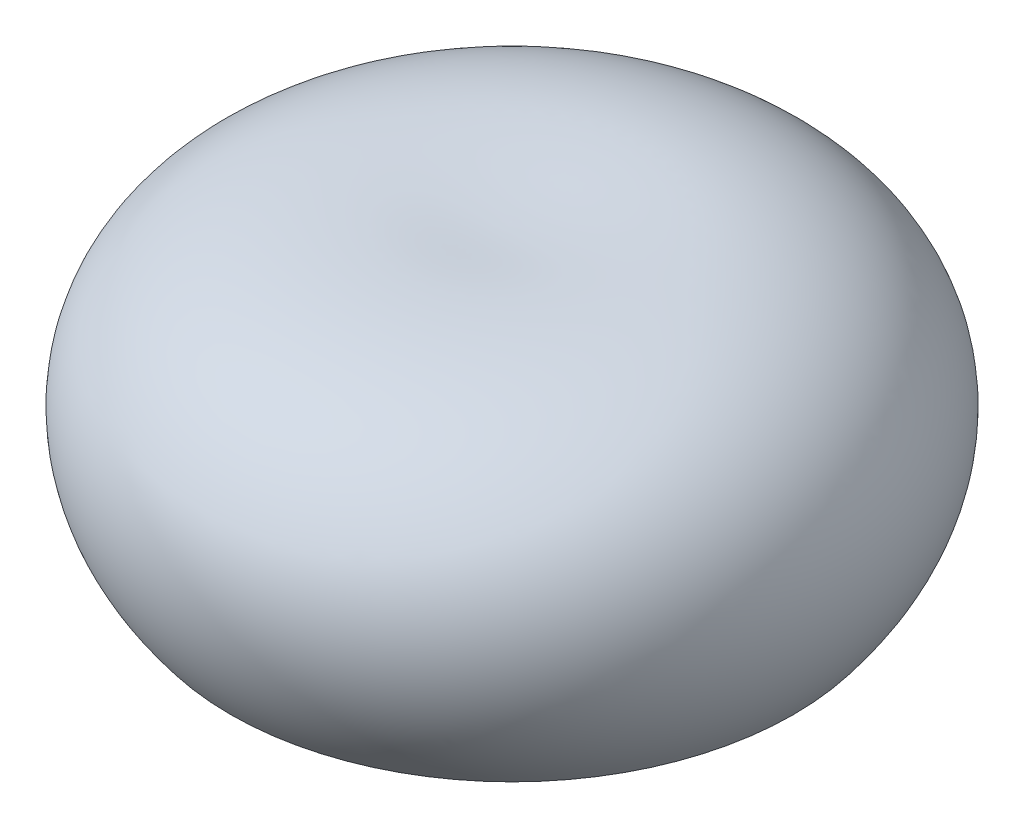
from build123d import *


with BuildPart() as part:
    # 草图3 → 旋转1 (revolve)
    with BuildSketch(Plane.XY):
        with BuildLine():
            Line((0, 7), (0, 0))
            Line((0, 0), (6.871524, 0))
            add(Edge.make_bspline(
                [(0, 7), (0.073827133, 6.999533892), (0.178318357, 6.998874186), (0.306371082, 7.001499066), (0.380532001, 7.003447371), (0.44163275, 7.005414874), (0.495099375, 7.007375358), (0.543337939, 7.009328467), (0.587692174, 7.011274662), (0.62900892, 7.013208302), (0.667864574, 7.01513245), (0.704674056, 7.01704083), (0.739746516, 7.018935719), (0.773321365, 7.020815477), (0.805587195, 7.022680946), (0.836696698, 7.024531001), (0.866775289, 7.026364097), (0.895926819, 7.028182386), (0.92424, 7.029984755), (0.951789678, 7.031768518), (0.978640164, 7.033538818), (1.004847801, 7.035290763), (1.030461401, 7.037026909), (1.055524621, 7.038747334), (1.080075561, 7.040450285), (1.104148873, 7.042135989), (1.127774491, 7.043805743), (1.150980061, 7.045459817), (1.173790345, 7.047096538), (1.196228349, 7.048715852), (1.21831425, 7.050319891), (1.240066936, 7.05190598), (1.261503173, 7.053476977), (1.282639187, 7.055030127), (1.303489485, 7.056567608), (1.324067415, 7.058089226), (1.344385372, 7.05959381), (1.364454785, 7.06108041), (1.38428631, 7.062553647), (1.403890354, 7.064008392), (1.423276267, 7.065448232), (1.442452636, 7.066870081), (1.461427601, 7.068276548), (1.480208588, 7.069666736), (1.498802901, 7.071041002), (1.517217542, 7.072399364), (1.535458874, 7.073741376), (1.553532799, 7.075068082), (1.571445213, 7.076376654), (1.589201149, 7.077671204), (1.606806139, 7.078949351), (1.624264792, 7.080211552), (1.641582107, 7.081457816), (1.65876215, 7.082687569), (1.675808752, 7.08390315), (1.692726084, 7.085102192), (1.709518068, 7.086285448), (1.726188441, 7.087452225), (1.742740379, 7.088604811), (1.759177426, 7.089740488), (1.775502371, 7.090861982), (1.791718366, 7.091967091), (1.807828401, 7.09305595), (1.823835055, 7.094130165), (1.839741065, 7.095189049), (1.85554896, 7.096234019), (1.871261098, 7.097259952), (1.886879701, 7.098273623), (1.902406998, 7.099271914), (1.917845712, 7.100253549), (1.933197649, 7.101221273), (1.948464748, 7.102171391), (1.963648643, 7.103109491), (1.978751408, 7.104029595), (1.993774643, 7.104937619), (2.008720735, 7.105827809), (2.02359065, 7.106705638), (2.038386356, 7.107566375), (2.053109061, 7.108412093), (2.067760644, 7.109244979), (2.082342731, 7.110060174), (2.096856351, 7.110862757), (2.111302695, 7.111649647), (2.125683354, 7.112421865), (2.139999726, 7.113178548), (2.154253027, 7.113921927), (2.16844436, 7.114650026), (2.182574738, 7.115362568), (2.196645325, 7.116062617), (2.210657444, 7.116744277), (2.224611994, 7.11741581), (2.238510113, 7.11806838), (2.252352674, 7.118710787), (2.266140749, 7.119334935), (2.27987541, 7.11994616), (2.293557055, 7.120543437), (2.307187085, 7.121125216), (2.320766088, 7.121693253), (2.334295403, 7.122247514), (2.347775404, 7.122786663), (2.361207128, 7.123309997), (2.374590743, 7.123821817), (2.387927781, 7.124317303), (2.40121842, 7.124799912), (2.414463811, 7.125266091), (2.42766443, 7.125720992), (2.440821131, 7.126159489), (2.453934464, 7.126584694), (2.46700514, 7.126995587), (2.480033455, 7.127393071), (2.493020504, 7.127774283), (2.505966464, 7.128144259), (2.518872515, 7.128497291), (2.53173881, 7.128839321), (2.544566191, 7.12916436), (2.557354824, 7.129478356), (2.570105535, 7.129775418), (2.582818505, 7.130061396), (2.595494544, 7.13033055), (2.608134199, 7.130588093), (2.620737876, 7.130830963), (2.633305882, 7.131060023), (2.645838889, 7.131275039), (2.658337228, 7.131476135), (2.670801578, 7.131662797), (2.683232241, 7.131837195), (2.695629583, 7.131997104), (2.707994257, 7.132143137), (2.720326263, 7.132275252), (2.732626277, 7.132392878), (2.74489461, 7.132498364), (2.757131624, 7.132588915), (2.769337959, 7.132667332), (2.781513968, 7.132731228), (2.793659642, 7.132781331), (2.805775651, 7.132817122), (2.817861991, 7.132839974), (2.829919332, 7.132850856), (2.841948005, 7.132844583), (2.853948349, 7.132828886), (2.865920688, 7.132796049), (2.877865028, 7.132751192), (2.889781706, 7.132693532), (2.901671376, 7.13262113), (2.913534055, 7.132536469), (2.925370399, 7.132437615), (2.937180391, 7.132323773), (2.948964424, 7.132200075), (2.960722739, 7.132058795), (2.972455433, 7.13190768), (2.984163107, 7.131741519), (2.995845773, 7.131561314), (3.007504115, 7.131368402), (3.019137788, 7.131162311), (3.030747477, 7.130943692), (3.042332803, 7.130710275), (3.053894828, 7.130464707), (3.065433155, 7.130204358), (3.076948499, 7.129931482), (3.088440504, 7.129645373), (3.099909865, 7.129346746), (3.111356854, 7.129033383), (3.122781534, 7.128707543), (3.134184204, 7.128368389), (3.145564902, 7.128016801), (3.156923889, 7.127650437), (3.168261235, 7.127271563), (3.179577238, 7.126879419), (3.190872277, 7.126474928), (3.202146231, 7.126055113), (3.213399629, 7.125624928), (3.224632274, 7.125179472), (3.235844622, 7.124721627), (3.247036956, 7.124250438), (3.258209338, 7.123767022), (3.269361943, 7.123268103), (3.280494695, 7.122759108), (3.291607959, 7.122234128), (3.302701711, 7.121699042), (3.313776343, 7.121148487), (3.324832028, 7.12058567), (3.335869035, 7.120009645), (3.346887376, 7.119420627), (3.357887055, 7.11881868), (3.368868395, 7.118203643), (3.379831407, 7.117575692), (3.390776409, 7.116934577), (3.401703467, 7.116281047), (3.412612724, 7.115612321), (3.423504444, 7.11493271), (3.434378498, 7.114240055), (3.44523475, 7.113532344), (3.456074141, 7.112813747), (3.466896485, 7.112081762), (3.477701817, 7.111336625), (3.488489885, 7.110579101), (3.499261125, 7.109806343), (3.510016192, 7.109022811), (3.520754863, 7.108225739), (3.531476876, 7.107415787), (3.542182545, 7.106592699), (3.552872223, 7.105756727), (3.563545915, 7.104907913), (3.574203518, 7.104045357), (3.584845313, 7.103172137), (3.595471594, 7.102283709), (3.606082229, 7.101382573), (3.616677284, 7.100469781), (3.627256687, 7.099544119), (3.637820904, 7.098603366), (3.648370328, 7.097651946), (3.658904656, 7.096686772), (3.669423667, 7.095708786), (3.67992769, 7.094717923), (3.690416948, 7.093713383), (3.700891776, 7.092698276), (3.71135197, 7.091667419), (3.721797724, 7.090625877), (3.732229124, 7.089571093), (3.742645685, 7.088501635), (3.753048344, 7.087420478), (3.763436836, 7.086328227), (3.773811426, 7.085220735), (3.784171725, 7.084100672), (3.794518457, 7.082968843), (3.804851134, 7.081823846), (3.815170148, 7.080665884), (3.825475479, 7.079494772), (3.835767183, 7.078311001), (3.84604542, 7.077113435), (3.856310283, 7.075905342), (3.866561442, 7.074681465), (3.876799547, 7.073446927), (3.887024559, 7.07219893), (3.897236473, 7.070937498), (3.907435665, 7.069665283), (3.917621172, 7.0683776), (3.927794251, 7.067078815), (3.937954277, 7.065766934), (3.948101629, 7.064441996), (3.958235857, 7.063103463), (3.968358062, 7.06175425), (3.978467235, 7.06038965), (3.988564318, 7.059013852), (3.998648667, 7.057624891), (4.008720701, 7.056223059), (4.018780237, 7.054807393), (4.028827819, 7.053381402), (4.038862939, 7.051939503), (4.048886063, 7.050486965), (4.058897075, 7.049020967), (4.068895971, 7.047541534), (4.0788832, 7.04605133), (4.088857991, 7.044545536), (4.098821127, 7.043029031), (4.108772433, 7.041498786), (4.118711818, 7.039956047), (4.128639788, 7.038399785), (4.138555747, 7.036830796), (4.148460496, 7.035249914), (4.158353495, 7.033655841), (4.168235195, 7.032048984), (4.178105515, 7.030428832), (4.18796423, 7.02879606), (4.197811442, 7.027149606), (4.207647567, 7.025491953), (4.217472252, 7.023820992), (4.227285893, 7.022136783), (4.237088274, 7.020439997), (4.246879619, 7.018729994), (4.256659491, 7.017006548), (4.266428764, 7.015272353), (4.276186825, 7.013522435), (4.285934358, 7.011762152), (4.295670652, 7.009987873), (4.305396008, 7.008200935), (4.315110558, 7.006400587), (4.324814837, 7.004589353), (4.334507582, 7.002762599), (4.344190052, 7.000924937), (4.35386173, 6.999073937), (4.36352275, 6.99720998), (4.373173066, 6.995332832), (4.382813104, 6.993442966), (4.392442644, 6.991539612), (4.40206195, 6.989625421), (4.411669961, 6.987695421), (4.421268286, 6.98575531), (4.430855693, 6.983799644), (4.440433174, 6.981832979), (4.450000162, 6.979852863), (4.459556867, 6.977859996), (4.469103214, 6.975854), (4.478639363, 6.973834416), (4.488165747, 6.971804498), (4.49768153, 6.969758755), (4.507187098, 6.967700589), (4.516683109, 6.965631446), (4.526168423, 6.963546451), (4.535644276, 6.961450921), (4.545110133, 6.95934238), (4.554565447, 6.957218423), (4.564011046, 6.955084215), (4.573446596, 6.952935655), (4.582872499, 6.950775294), (4.592288195, 6.948599592), (4.601694389, 6.94641305), (4.61109067, 6.944212776), (4.620477393, 6.941999965), (4.6298544, 6.939773941), (4.63922141, 6.937534937), (4.648578436, 6.935282993), (4.657925713, 6.933017712), (4.667263621, 6.930740315), (4.676591598, 6.928447484), (4.6859105, 6.926144058), (4.695219492, 6.923826975), (4.704518775, 6.921496728), (4.713808688, 6.919154318), (4.723088659, 6.916796511), (4.732359547, 6.914428003), (4.741621012, 6.912046127), (4.750872387, 6.909649623), (4.760115045, 6.907242158), (4.769347568, 6.904819891), (4.778570929, 6.90238495), (4.787784742, 6.899936539), (4.796989787, 6.89747724), (4.806185087, 6.895003064), (4.815370786, 6.892514574), (4.824547673, 6.890015011), (4.833715144, 6.887502128), (4.842872512, 6.88497467), (4.852021466, 6.882435993), (4.861160709, 6.879882955), (4.870291028, 6.87731686), (4.879411734, 6.874737958), (4.888523519, 6.872145992), (4.897625582, 6.869539672), (4.906719263, 6.866922171), (4.915803066, 6.864289775), (4.924877807, 6.861644991), (4.933943581, 6.858986975), (4.94299965, 6.856314704), (4.952047615, 6.853631002), (4.961085825, 6.850932877), (4.970115368, 6.848222194), (4.979134964, 6.845496485), (4.988146403, 6.84276022), (4.997148149, 6.84000868), (5.006141431, 6.83724522), (5.015125011, 6.834466485), (5.02410015, 6.831677299), (5.033065706, 6.828872897), (5.042022067, 6.826054552), (5.050970484, 6.823225166), (5.059908979, 6.820380913), (5.068838767, 6.817523916), (5.077759314, 6.814652837), (5.086671321, 6.811768821), (5.095574521, 6.808872058), (5.104468083, 6.805961029), (5.113352619, 6.803036595), (5.1222286, 6.800100168), (5.131095614, 6.797148503), (5.139954357, 6.794185351), (5.148803358, 6.791206655), (5.157643688, 6.788216255), (5.16647445, 6.785210206), (5.175297627, 6.782194633), (5.18411069, 6.779161498), (5.192915495, 6.776116863), (5.201711701, 6.773059081), (5.210498474, 6.769986725), (5.21927674, 6.766902107), (5.228045508, 6.763802744), (5.236806024, 6.760690887), (5.245557278, 6.757564957), (5.254300049, 6.754425875), (5.26303357, 6.751272767), (5.271758788, 6.748106997), (5.280474823, 6.744927049), (5.289181844, 6.741732494), (5.29788063, 6.73852635), (5.306569858, 6.735304461), (5.315250922, 6.732071155), (5.323922602, 6.728822598), (5.332586169, 6.725562394), (5.341239407, 6.722285342), (5.349885207, 6.718998409), (5.358520913, 6.715694395), (5.367149003, 6.712379128), (5.375767722, 6.709048695), (5.384377988, 6.705706009), (5.392978965, 6.702348911), (5.401571278, 6.698977818), (5.410154755, 6.695592637), (5.418730316, 6.692195344), (5.427295533, 6.688781343), (5.435853353, 6.685357356), (5.444400779, 6.681916555), (5.452940589, 6.67846403), (5.4614706, 6.674995864), (5.469992406, 6.671514836), (5.478504862, 6.668019623), (5.487009418, 6.664512264), (5.495504116, 6.660988362), (5.503990977, 6.657453258), (5.512468388, 6.65390261), (5.520937205, 6.650338931), (5.529397195, 6.64676087), (5.537848221, 6.643168893), (5.546290215, 6.639562842), (5.5547233, 6.635943001), (5.563147213, 6.632308328), (5.571563357, 6.628662494), (5.579969204, 6.624999241), (5.588367621, 6.621325253), (5.596756017, 6.61763451), (5.605136592, 6.61393211), (5.613507338, 6.610213829), (5.621869127, 6.606481658), (5.630222843, 6.60273681), (5.638567155, 6.598977057), (5.646902606, 6.595202545), (5.655229219, 6.591415123), (5.663546642, 6.587612553), (5.671855457, 6.583796843), (5.680155206, 6.579966985), (5.688445961, 6.576122804), (5.696727209, 6.572263539), (5.705000773, 6.568392043), (5.713264489, 6.564504733), (5.721519508, 6.560603741), (5.729765803, 6.55668899), (5.738002068, 6.55275878), (5.746230019, 6.548815672), (5.754448851, 6.544857976), (5.762658307, 6.540884486), (5.770859898, 6.536899), (5.779051608, 6.532897702), (5.787234608, 6.528882671), (5.795408715, 6.524854192), (5.803572831, 6.520809379), (5.811728496, 6.516752012), (5.819875135, 6.512679588), (5.828012468, 6.508592886), (5.836140991, 6.50449189), (5.844259923, 6.500375398), (5.852370543, 6.496245929), (5.860471776, 6.492102014), (5.868563261, 6.487942623), (5.87664547, 6.483768374), (5.884720161, 6.479582312), (5.892783757, 6.475378525), (5.900838844, 6.47116166), (5.908885114, 6.466930805), (5.916921597, 6.462684756), (5.924949633, 6.458424748), (5.932967338, 6.454148537), (5.940977502, 6.449860053), (5.948976347, 6.445554492), (5.956967513, 6.441236998), (5.964947875, 6.436902452), (5.972920211, 6.432554705), (5.980883037, 6.428191956), (5.988835952, 6.423813497), (5.996780244, 6.41942166), (6.004715096, 6.415014956), (6.01263996, 6.410592415), (6.020556163, 6.406157004), (6.028462416, 6.401705237), (6.036359963, 6.397240168), (6.044247324, 6.392758592), (6.052125055, 6.388262424), (6.059994643, 6.38375275), (6.067853728, 6.379226947), (6.075703555, 6.374686283), (6.083544222, 6.370131823), (6.091375221, 6.365561786), (6.099196402, 6.360976492), (6.107008259, 6.356376782), (6.114810255, 6.35176174), (6.122602508, 6.34713157), (6.130385168, 6.342486304), (6.138159628, 6.337827926), (6.145923267, 6.333152623), (6.153677365, 6.32846275), (6.161421526, 6.323757433), (6.169156335, 6.319037634), (6.176881721, 6.314302893), (6.184596204, 6.309551146), (6.192302793, 6.304786938), (6.199998088, 6.300005435), (6.207684915, 6.295210528), (6.215361251, 6.290399829), (6.223027942, 6.285573499), (6.230684163, 6.280731428), (6.238331834, 6.275875785), (6.245968443, 6.271003471), (6.253595824, 6.266116697), (6.261212544, 6.26121356), (6.268819702, 6.256295258), (6.276417463, 6.251362883), (6.284004924, 6.2464142), (6.29158282, 6.241451023), (6.299149384, 6.23646998), (6.306707815, 6.231476944), (6.314254907, 6.226466541), (6.321791744, 6.2214401), (6.329319857, 6.216399897), (6.33683667, 6.211342421), (6.344343619, 6.206270315), (6.351841259, 6.201184045), (6.359326406, 6.196078783), (6.366804294, 6.190962021), (6.374269679, 6.18582627), (6.381725764, 6.180676366), (6.389172353, 6.175511512), (6.396607654, 6.170329618), (6.404032733, 6.165132224), (6.411448329, 6.159920842), (6.41885173, 6.154691153), (6.426246232, 6.149447496), (6.433629763, 6.14418714), (6.441004374, 6.138912758), (6.448366686, 6.133620431), (6.455719187, 6.128313298), (6.463061071, 6.122990563), (6.470392195, 6.11765124), (6.477713217, 6.112296238), (6.485024095, 6.106925493), (6.492324137, 6.101538513), (6.499612814, 6.096135378), (6.506891576, 6.090717254), (6.514159147, 6.085282423), (6.521416328, 6.079831188), (6.528662868, 6.074364322), (6.535899543, 6.068882511), (6.543124112, 6.063383242), (6.550338616, 6.057868532), (6.557540979, 6.052335903), (6.564734231, 6.046789729), (6.571915622, 6.041226003), (6.579086321, 6.035646344), (6.58624622, 6.030050182), (6.593395606, 6.024438728), (6.600532037, 6.018808795), (6.607659703, 6.01316536), (6.614775621, 6.007504219), (6.621880335, 6.00182616), (6.628974316, 5.996132518), (6.636056393, 5.990422166), (6.643127774, 5.984695859), (6.650188613, 5.978953446), (6.657237361, 5.973193433), (6.664274485, 5.967416741), (6.671301723, 5.961625471), (6.678316701, 5.955816005), (6.685320437, 5.949990388), (6.692312838, 5.944147703), (6.699294373, 5.93828964), (6.70626378, 5.932413963), (6.713221842, 5.926522002), (6.720168473, 5.92061326), (6.72710383, 5.914687921), (6.734027814, 5.908746255), (6.74093982, 5.902786841), (6.747840861, 5.896811238), (6.754729475, 5.890818094), (6.761606891, 5.884809202), (6.768471887, 5.878782783), (6.775325873, 5.872740111), (6.7821679, 5.866680106), (6.788997897, 5.860602695), (6.795816904, 5.854509413), (6.802622934, 5.848397668), (6.80941793, 5.842270001), (6.816200905, 5.836125305), (6.822971003, 5.829962645), (6.829729916, 5.823783883), (6.836477332, 5.817588326), (6.843210595, 5.811373438), (6.849934374, 5.805144298), (6.856643941, 5.79889577), (6.863342046, 5.79263085), (6.870028327, 5.78634878), (6.876702009, 5.780049093), (6.883363037, 5.773731737), (6.890012386, 5.767397736), (6.896649052, 5.761046031), (6.903273089, 5.754676689), (6.909885403, 5.748290648), (6.916485362, 5.741886912), (6.923072103, 5.735464943), (6.929646105, 5.729025572), (6.936208465, 5.722569908), (6.942757431, 5.7160955), (6.949294139, 5.70960384), (6.955818424, 5.703094757), (6.962329499, 5.696567794), (6.968827171, 5.690022437), (6.975313488, 5.683460713), (6.981786483, 5.676880997), (6.988245459, 5.670282285), (6.994692608, 5.66366672), (7.001126145, 5.65703257), (7.007547938, 5.650381633), (7.013955148, 5.643711504), (7.020350612, 5.637024899), (7.026731837, 5.630319107), (7.033100301, 5.623595863), (7.039455576, 5.616854439), (7.045797881, 5.610095356), (7.052126638, 5.603317735), (7.058441296, 5.596521406), (7.064743924, 5.589708287), (7.071032997, 5.582876621), (7.077307242, 5.576025256), (7.083570042, 5.569157588), (7.089817601, 5.562270482), (7.09605199, 5.555365163), (7.102272687, 5.548441488), (7.108479705, 5.541499467), (7.114673022, 5.534539083), (7.120852695, 5.527560387), (7.127019059, 5.520563337), (7.133170693, 5.513547313), (7.139309051, 5.506513255), (7.145433062, 5.499460226), (7.151542742, 5.492388248), (7.157639101, 5.485298187), (7.163721055, 5.47818911), (7.169788822, 5.471061491), (7.17584236, 5.463914679), (7.181881859, 5.456749448), (7.187907074, 5.449564979), (7.193918168, 5.442362298), (7.199914135, 5.435139955), (7.205896069, 5.427898866), (7.211864309, 5.420639572), (7.217816016, 5.413359478), (7.223755295, 5.406062212), (7.229679087, 5.398745005), (7.23558862, 5.391409061), (7.24148172, 5.384052704), (7.247362726, 5.376679333), (7.253226039, 5.369284553), (7.259076625, 5.361871909), (7.264911214, 5.354438881), (7.270731246, 5.34698687), (7.276536603, 5.339515775), (7.282326185, 5.332024748), (7.288101644, 5.324514985), (7.293860524, 5.316984598), (7.299604355, 5.309434766), (7.305333219, 5.301865627), (7.311048043, 5.294277792), (7.316745151, 5.286668502), (7.322428806, 5.279040867), (7.328095191, 5.27139246), (7.333748018, 5.26372561), (7.339383602, 5.256037596), (7.345003441, 5.248329774), (7.350607576, 5.24060226), (7.356197062, 5.232855479), (7.361769311, 5.225087567), (7.367327047, 5.217300387), (7.372867655, 5.209492402), (7.378392764, 5.201664441), (7.383901626, 5.193816306), (7.389395182, 5.185948552), (7.394870551, 5.178058945), (7.400331839, 5.170150568), (7.40577609, 5.162221364), (7.411202687, 5.154271155), (7.416614075, 5.146301047), (7.42200876, 5.138310353), (7.427387187, 5.130299265), (7.432747628, 5.122266964), (7.438093498, 5.114215056), (7.44342071, 5.106141162), (7.448732261, 5.098047149), (7.454025617, 5.089931807), (7.459304585, 5.08179716), (7.464564054, 5.073639892), (7.469806842, 5.065462052), (7.475033465, 5.057263742), (7.480242048, 5.04904377), (7.485434295, 5.040803095), (7.490608058, 5.032540697), (7.495765282, 5.024258003), (7.500904358, 5.015953469), (7.506026237, 5.007627892), (7.511130254, 4.99928086), (7.516216356, 4.990912346), (7.521285551, 4.982522624), (7.526336177, 4.974110691), (7.531369553, 4.965677541), (7.5363842, 4.957222623), (7.54138155, 4.948746455), (7.546360421, 4.940248338), (7.55132169, 4.931728645), (7.556263132, 4.923186421), (7.561187918, 4.914623164), (7.566093037, 4.906037288), (7.570982211, 4.897430622), (7.575849112, 4.888799728), (7.580700946, 4.880148715), (7.58553133, 4.871473957), (7.590344925, 4.862778096), (7.595138433, 4.85405963), (7.599912969, 4.845318517), (7.60466865, 4.836555148), (7.609405502, 4.827769028), (7.614124155, 4.818961177), (7.618821179, 4.810129596), (7.623502644, 4.801277186), (7.628160136, 4.792399492), (7.632802297, 4.783501245), (7.63742173, 4.774578558), (7.64202277, 4.765633539), (7.646605203, 4.756666055), (7.651165622, 4.747674378), (7.655708216, 4.738660969), (7.660228902, 4.7296231), (7.664730914, 4.72056306), (7.66921221, 4.711478833), (7.673673795, 4.702371913), (7.678115293, 4.693241442), (7.682535109, 4.684087146), (7.68693506, 4.67490908), (7.691315256, 4.665707777), (7.695673014, 4.656481969), (7.700011109, 4.647233459), (7.704328227, 4.637960648), (7.70862543, 4.628664337), (7.712900165, 4.619343015), (7.717154186, 4.609997981), (7.721387369, 4.600629167), (7.725598402, 4.591235652), (7.729788165, 4.581817835), (7.733957334, 4.572376012), (7.738104511, 4.562909708), (7.742229312, 4.553418907), (7.746332491, 4.543903129), (7.750414558, 4.534363061), (7.754473204, 4.524797248), (7.75851153, 4.515207953), (7.762526542, 4.505593105), (7.766519771, 4.495953621), (7.770489039, 4.486288002), (7.774439203, 4.476598502), (7.778363151, 4.466882091), (7.7822669, 4.457141611), (7.786145474, 4.447374794), (7.79000259, 4.437583259), (7.793836733, 4.427765933), (7.797647649, 4.417922852), (7.80143588, 4.408054019), (7.805199598, 4.398159195), (7.808939908, 4.38823847), (7.812656525, 4.378291614), (7.816351124, 4.368319032), (7.820019587, 4.358319207), (7.823666138, 4.348293933), (7.827286398, 4.338241377), (7.830885147, 4.328163501), (7.834458135, 4.318058442), (7.838005484, 4.307925933), (7.84153145, 4.297767564), (7.845029471, 4.28758128), (7.848505208, 4.27736893), (7.851955197, 4.267129317), (7.855378833, 4.256861589), (7.858779006, 4.246567484), (7.862153266, 4.236245406), (7.865501822, 4.225895879), (7.868826293, 4.215518752), (7.872123952, 4.205113925), (7.875396361, 4.194681334), (7.878642135, 4.184220543), (7.881862079, 4.173731475), (7.88505633, 4.163214599), (7.888223225, 4.152669079), (7.891364118, 4.142094997), (7.894479541, 4.131492595), (7.897566006, 4.120860859), (7.900627452, 4.11020103), (7.903660986, 4.099512179), (7.906668909, 4.088794475), (7.909646911, 4.078047051), (7.912599622, 4.067270617), (7.915523386, 4.056464829), (7.918419176, 4.045629298), (7.921288755, 4.034764571), (7.924128358, 4.023869323), (7.926940354, 4.012944268), (7.929724655, 4.001989373), (7.932479291, 3.991003809), (7.935206875, 3.979988394), (7.937903098, 3.968941985), (7.940572778, 3.957865509), (7.943212509, 3.946758132), (7.945822874, 3.935619492), (7.948402355, 3.924449571), (7.950953662, 3.91324866), (7.953474714, 3.90201628), (7.955965461, 3.8907525), (7.958426906, 3.879457277), (7.96085662, 3.868129751), (7.963256643, 3.856770435), (7.965625852, 3.845378752), (7.967963543, 3.833954963), (7.970271131, 3.822498753), (7.972545235, 3.811009386), (7.974791247, 3.799487718), (7.977002638, 3.787932806), (7.979182691, 3.776344696), (7.981332064, 3.764723493), (7.983447538, 3.753068275), (7.985532121, 3.741379711), (7.987582751, 3.729657249), (7.98960087, 3.717900542), (7.991586162, 3.706109915), (7.993536398, 3.694284285), (7.995456365, 3.682424541), (7.997339946, 3.670529353), (7.999189464, 3.658599168), (8.001007683, 3.646634105), (8.002787223, 3.634633008), (8.004536478, 3.62259694), (8.006247855, 3.610524735), (8.007924962, 3.598416354), (8.009567183, 3.586271694), (8.011172681, 3.574090186), (8.012744497, 3.561872309), (8.014277452, 3.549617029), (8.015777601, 3.537325224), (8.017237739, 3.524995639), (8.018663076, 3.512628652), (8.020051363, 3.500223317), (8.021400739, 3.487779811), (8.02271432, 3.475297839), (8.023988897, 3.462777393), (8.025226396, 3.450217738), (8.02642385, 3.437618917), (8.027584078, 3.4249809), (8.028705416, 3.412303219), (8.029785868, 3.399585406), (8.030828287, 3.386827063), (8.031829946, 3.374028297), (8.032792442, 3.361188618), (8.033712735, 3.348307805), (8.034594626, 3.335385503), (8.035432523, 3.322421316), (8.036232716, 3.309415376), (8.036987673, 3.296366867), (8.037703413, 3.28327587), (8.038375121, 3.270141777), (8.039004165, 3.256964369), (8.039589992, 3.243743285), (8.040133264, 3.230477899), (8.040632009, 3.217168145), (8.041087271, 3.203813753), (8.041497124, 3.190414334), (8.041862089, 3.176969254), (8.042181933, 3.163478505), (8.042457114, 3.149941436), (8.042686211, 3.136358027), (8.042868116, 3.122727276), (8.043002966, 3.109049526), (8.043091166, 3.095323779), (8.043131047, 3.081549694), (8.043122814, 3.067726945), (8.043067362, 3.053855188), (8.04296086, 3.039933773), (8.04280576, 3.025962358), (8.042602169, 3.011940256), (8.042346997, 2.997867502), (8.042040724, 2.983743088), (8.041684381, 2.969566963), (8.041273415, 2.955338587), (8.040812957, 2.941057128), (8.040299088, 2.92672235), (8.039730428, 2.912333299), (8.039110082, 2.897889817), (8.038433611, 2.883391077), (8.037703, 2.868836945), (8.036915195, 2.85422658), (8.036074221, 2.839559034), (8.035173081, 2.82483438), (8.03421799, 2.810051161), (8.033202376, 2.795209791), (8.032129373, 2.780308671), (8.030997805, 2.765347485), (8.029804215, 2.750325455), (8.028551351, 2.735241983), (8.027237389, 2.720096513), (8.025861056, 2.704888441), (8.024423446, 2.689616569), (8.022920881, 2.674280184), (8.021355631, 2.658878263), (8.019722416, 2.643410687), (8.018027201, 2.627876053), (8.016263955, 2.612273595), (8.01443288, 2.596602491), (8.012533406, 2.580862105), (8.010567073, 2.565051115), (8.008528188, 2.549169156), (8.006420905, 2.533214145), (8.004239189, 2.517186166), (8.001986131, 2.501083346), (7.999660351, 2.484905098), (7.997259206, 2.468650612), (7.994781904, 2.452318482), (7.992228021, 2.435907619), (7.98959568, 2.419416493), (7.986884586, 2.402843993), (7.984093493, 2.386188823), (7.981221484, 2.369449912), (7.978266317, 2.352626079), (7.975226642, 2.335715736), (7.972104579, 2.318716846), (7.968892204, 2.301629026), (7.96559505, 2.284449531), (7.962206088, 2.267177909), (7.958728562, 2.249811802), (7.955156789, 2.232350479), (7.951493025, 2.214791073), (7.947732399, 2.197132316), (7.943875738, 2.179371942), (7.939918716, 2.161508607), (7.935863557, 2.14353962), (7.931702023, 2.125463888), (7.927439857, 2.107277885), (7.923068733, 2.088980571), (7.918591011, 2.070568759), (7.914001674, 2.052040833), (7.909298838, 2.033394035), (7.904482121, 2.014625191), (7.899546036, 1.995732206), (7.894492603, 1.976711425), (7.88931318, 1.957561618), (7.884011447, 1.938277563), (7.878579797, 1.91885769), (7.873017173, 1.899297716), (7.867320676, 1.879594367), (7.861487338, 1.85974353), (7.855512469, 1.839741943), (7.849394428, 1.819584894), (7.843126049, 1.799269221), (7.836707928, 1.778789176), (7.830132832, 1.758140863), (7.823398223, 1.737319056), (7.8164993, 1.716318122), (7.80943092, 1.695133099), (7.802186127, 1.673758776), (7.794764789, 1.652187377), (7.787156529, 1.630413955), (7.779357217, 1.608430762), (7.771361341, 1.586230611), (7.763160488, 1.563806258), (7.754750512, 1.541148197), (7.746120689, 1.518248683), (7.737265217, 1.495097435), (7.728174395, 1.471684966), (7.718839043, 1.448000361), (7.709251789, 1.424031225), (7.699397336, 1.399766559), (7.68926991, 1.375190965), (7.678852073, 1.350291485), (7.668136035, 1.325050659), (7.65710216, 1.299452572), (7.645736149, 1.273478008), (7.634023807, 1.247105041), (7.621942698, 1.220313153), (7.609474637, 1.193076087), (7.596596098, 1.165366551), (7.583281972, 1.137153935), (7.569501749, 1.10840511), (7.555228619, 1.079079725), (7.540422008, 1.049136817), (7.525047037, 1.018525177), (7.509052502, 0.987191409), (7.492391376, 0.955068273), (7.474996845, 0.922084111), (7.456803632, 0.888148026), (7.437722696, 0.853158989), (7.417655638, 0.816991916), (7.396480397, 0.779494718), (7.374044852, 0.7404813), (7.350160446, 0.699713086), (7.324577872, 0.6568859), (7.296975167, 0.611586116), (7.266893365, 0.56324639), (7.233672572, 0.511026735), (7.196266962, 0.453598037), (7.152819449, 0.388578708), (7.099204996, 0.310585168), (7.005651607, 0.178987117), (6.926892082, 0.073886157), (6.871524, 0)],
                knots=[0, 0, 0, 0, 0.016297596, 0.023066801, 0.028274264, 0.032675414, 0.036562599, 0.040085723, 0.043333494, 0.046363861, 0.049216979, 0.051921959, 0.054501007, 0.056971032, 0.059345708, 0.061636059, 0.063851048, 0.065998321, 0.068084197, 0.070114253, 0.072093056, 0.074024709, 0.07591289, 0.077760612, 0.079570806, 0.081345897, 0.083088166, 0.084799522, 0.086481869, 0.088136821, 0.089765927, 0.091370501, 0.092951798, 0.094510986, 0.096049171, 0.097567308, 0.099066272, 0.100546943, 0.102010067, 0.10345644, 0.104886727, 0.106301583, 0.107701529, 0.109087223, 0.110459108, 0.111817696, 0.113163574, 0.114497036, 0.115818518, 0.117128543, 0.118427327, 0.11971531, 0.120992859, 0.122260269, 0.123517763, 0.124765706, 0.12600439, 0.127234035, 0.128454941, 0.129667324, 0.130871408, 0.132067409, 0.133255549, 0.134436051, 0.135609064, 0.136774809, 0.137933495, 0.139085138, 0.140230101, 0.141368453, 0.142500346, 0.143625996, 0.144745412, 0.145858807, 0.146966337, 0.148068067, 0.149164226, 0.150254806, 0.15133996, 0.152419839, 0.153494582, 0.154564199, 0.155628831, 0.156688555, 0.157743516, 0.158793794, 0.159839459, 0.160880584, 0.161917248, 0.162949591, 0.163977625, 0.165001487, 0.166021187, 0.167036864, 0.168048525, 0.169056318, 0.170060167, 0.171060296, 0.172056706, 0.173049469, 0.174038585, 0.175024208, 0.17600626, 0.176984965, 0.177960247, 0.178932187, 0.179900927, 0.180866396, 0.181828671, 0.182787897, 0.183743928, 0.184696989, 0.185647076, 0.186594196, 0.187538417, 0.18847982, 0.189418327, 0.190354089, 0.191287106, 0.192217381, 0.19314506, 0.194070071, 0.194992415, 0.195912313, 0.196829621, 0.197744413, 0.198656836, 0.199566745, 0.200474288, 0.201379466, 0.20228228, 0.203182804, 0.204081041, 0.204977064, 0.205870875, 0.206762401, 0.207651864, 0.208539119, 0.209424238, 0.210307372, 0.211188374, 0.212067319, 0.212944281, 0.213819188, 0.214692188, 0.21556321, 0.216432327, 0.21729954, 0.218164852, 0.219028336, 0.219889921, 0.220749755, 0.221607764, 0.222464025, 0.223318463, 0.224171229, 0.225022176, 0.225871526, 0.226719134, 0.227565072, 0.228409343, 0.229252023, 0.230093111, 0.230932535, 0.231770444, 0.232606767, 0.233441503, 0.234274728, 0.235106442, 0.235936649, 0.236765345, 0.23759261, 0.23841837, 0.239242699, 0.240065672, 0.240887146, 0.241707264, 0.242525959, 0.2433433, 0.244159221, 0.244973867, 0.245787166, 0.24659912, 0.247409802, 0.248219141, 0.249027212, 0.249834016, 0.250639554, 0.251443832, 0.252246916, 0.253048739, 0.253849305, 0.254648682, 0.255446947, 0.256243956, 0.257039784, 0.257834436, 0.258627978, 0.259420416, 0.260211678, 0.261001765, 0.261790826, 0.262578788, 0.263365579, 0.264151343, 0.264936017, 0.265719672, 0.26650223, 0.267283697, 0.268064155, 0.268843666, 0.26962209, 0.270399504, 0.271175908, 0.271951303, 0.272725758, 0.273499214, 0.274271732, 0.275043248, 0.275813843, 0.27658343, 0.277352158, 0.278119897, 0.278886787, 0.279652675, 0.280417717, 0.281181841, 0.281945048, 0.282707414, 0.283468866, 0.284229471, 0.284989175, 0.285748033, 0.286506057, 0.287263248, 0.288019599, 0.288775128, 0.289529747, 0.290283685, 0.291036725, 0.29178894, 0.292540397, 0.293291115, 0.29404093, 0.294790074, 0.295538401, 0.296285914, 0.297032748, 0.297778781, 0.298524067, 0.299268616, 0.300012431, 0.300755502, 0.301497853, 0.302239463, 0.302980345, 0.303720573, 0.304460004, 0.305198856, 0.305936902, 0.3066743, 0.307411052, 0.308147087, 0.308882478, 0.309617156, 0.310351182, 0.311084569, 0.311817246, 0.312549361, 0.31328077, 0.314011547, 0.314741681, 0.315471199, 0.316200149, 0.3169284, 0.317656028, 0.318383106, 0.319109549, 0.319835387, 0.320560593, 0.321285255, 0.322009304, 0.322732739, 0.323455636, 0.324177995, 0.324899732, 0.325620877, 0.326341475, 0.327061558, 0.327781024, 0.328499962, 0.329218375, 0.329936192, 0.330653485, 0.331370315, 0.332086497, 0.332802232, 0.333517437, 0.334232071, 0.334946248, 0.335659914, 0.336373015, 0.337085664, 0.337797735, 0.338509374, 0.339220526, 0.339931161, 0.340641297, 0.341351007, 0.342060221, 0.34276894, 0.343477168, 0.344184904, 0.344892223, 0.345599072, 0.34630549, 0.347011424, 0.347716875, 0.348421917, 0.349126499, 0.349830657, 0.35053434, 0.351237639, 0.351940447, 0.352642876, 0.353344836, 0.354046401, 0.354747553, 0.355448262, 0.356148599, 0.356848529, 0.357548001, 0.358247108, 0.358945741, 0.359644084, 0.360341976, 0.36103949, 0.361736557, 0.36243334, 0.36312966, 0.36382563, 0.36452123, 0.365216393, 0.365911282, 0.366605715, 0.367299878, 0.367993611, 0.368687006, 0.369380024, 0.370072708, 0.370765039, 0.371457041, 0.372148672, 0.372839907, 0.373530889, 0.374221505, 0.374911801, 0.375601686, 0.376291326, 0.37698063, 0.377669598, 0.378358257, 0.379046515, 0.379734514, 0.380422208, 0.381109647, 0.381796716, 0.382483464, 0.383169915, 0.383856094, 0.384541935, 0.385227532, 0.385912816, 0.386597814, 0.387282503, 0.387966911, 0.388651013, 0.389334907, 0.39001843, 0.390701749, 0.39138477, 0.392067521, 0.392750004, 0.393432265, 0.394114193, 0.394795902, 0.395477351, 0.396158517, 0.396839452, 0.397520082, 0.398200487, 0.398880684, 0.399560633, 0.400240311, 0.400919745, 0.401598938, 0.40227796, 0.402956717, 0.403635267, 0.40431353, 0.404991588, 0.405669391, 0.406347063, 0.407024414, 0.407701611, 0.408378559, 0.409055318, 0.4097319, 0.4104082, 0.411084356, 0.411760302, 0.412436041, 0.413111574, 0.413786904, 0.414462032, 0.415137, 0.415811734, 0.41648631, 0.417160723, 0.417834916, 0.418508951, 0.4191828, 0.419856435, 0.420529985, 0.421203289, 0.421876482, 0.422549434, 0.423222279, 0.423894954, 0.424567393, 0.425239764, 0.425911939, 0.426583983, 0.427255868, 0.427927596, 0.428599199, 0.429270552, 0.429941852, 0.430613035, 0.43128404, 0.431954933, 0.432625684, 0.433296295, 0.433966736, 0.434637108, 0.43530728, 0.435977421, 0.436647368, 0.437317222, 0.437987018, 0.438656626, 0.439326084, 0.439995523, 0.440664814, 0.441333996, 0.442003067, 0.442672031, 0.443340923, 0.444009647, 0.444678404, 0.445346963, 0.446015496, 0.446683835, 0.447352152, 0.44802038, 0.448688557, 0.44935662, 0.4500246, 0.450692537, 0.451360367, 0.452028122, 0.452695776, 0.453363459, 0.454030983, 0.454698477, 0.455365908, 0.456033351, 0.456700608, 0.45736791, 0.45803513, 0.458702273, 0.459369404, 0.460036463, 0.460703451, 0.461370435, 0.462037379, 0.462704299, 0.463371159, 0.464037962, 0.464704774, 0.465371533, 0.466038282, 0.466705008, 0.467371729, 0.46803837, 0.468705074, 0.469371679, 0.470038352, 0.470704956, 0.47137157, 0.472038159, 0.472704766, 0.473371352, 0.474037982, 0.474704537, 0.47537118, 0.476037794, 0.476704422, 0.477371025, 0.478037667, 0.478704373, 0.479371062, 0.480037758, 0.480704464, 0.481371204, 0.482037978, 0.482704792, 0.483371627, 0.484038486, 0.484705454, 0.48537239, 0.486039358, 0.486706385, 0.487373449, 0.488040595, 0.488707783, 0.489375043, 0.490042291, 0.490709632, 0.491377012, 0.49204449, 0.492712072, 0.4933797, 0.494047377, 0.494715062, 0.495382906, 0.496050808, 0.49671883, 0.497386872, 0.498055027, 0.498723251, 0.499391594, 0.500060027, 0.500728482, 0.501397122, 0.502065848, 0.502734663, 0.503403557, 0.504072559, 0.504741704, 0.505410996, 0.506080393, 0.506749839, 0.507419396, 0.508089169, 0.508759049, 0.509428992, 0.510099114, 0.510769352, 0.511439766, 0.512110256, 0.512780985, 0.51345174, 0.514122683, 0.514793819, 0.515465047, 0.516136474, 0.516808047, 0.517479825, 0.518151756, 0.518823796, 0.519495995, 0.520168413, 0.520840998, 0.521513753, 0.522186736, 0.522859841, 0.523533182, 0.524206706, 0.524880363, 0.525554265, 0.526228361, 0.52690265, 0.527577145, 0.52825184, 0.528926743, 0.529601857, 0.530277236, 0.530952781, 0.531628547, 0.532304589, 0.532980807, 0.533657258, 0.534333995, 0.535010969, 0.535688134, 0.536365545, 0.537043206, 0.537721171, 0.53839934, 0.53907777, 0.539756464, 0.540435425, 0.541114658, 0.541794115, 0.542473902, 0.543153972, 0.543834275, 0.544514923, 0.545195811, 0.545876947, 0.546558489, 0.547240232, 0.547922285, 0.548604704, 0.549287391, 0.549970345, 0.550653678, 0.551337344, 0.552021287, 0.552705572, 0.553390148, 0.554075123, 0.554760396, 0.555445972, 0.556131959, 0.556818256, 0.557504923, 0.558191909, 0.558879273, 0.55956702, 0.560255097, 0.560943565, 0.561632427, 0.562321585, 0.56301125, 0.563701218, 0.564391597, 0.565082345, 0.565773513, 0.566465104, 0.56715703, 0.567849435, 0.56854223, 0.569235419, 0.569929064, 0.5706231, 0.571317556, 0.572012469, 0.572707855, 0.573403662, 0.574099894, 0.574796613, 0.575493765, 0.576191369, 0.576889473, 0.577588024, 0.578287026, 0.578986556, 0.579686546, 0.580387015, 0.581087953, 0.581789438, 0.582491417, 0.583193833, 0.583896796, 0.584600325, 0.585304306, 0.586008863, 0.586713942, 0.587419547, 0.588125682, 0.58883237, 0.58953964, 0.590247413, 0.590955755, 0.59166465, 0.592374166, 0.593084203, 0.593794828, 0.594506027, 0.595217885, 0.595930285, 0.596643293, 0.597356892, 0.598071132, 0.598785995, 0.599501424, 0.600217548, 0.60093431, 0.601651677, 0.602369692, 0.603088321, 0.603807671, 0.604527646, 0.605248251, 0.605969592, 0.606691636, 0.607414326, 0.60813773, 0.60886179, 0.609586575, 0.610312089, 0.611038302, 0.611765192, 0.612492891, 0.613221277, 0.613950412, 0.614680344, 0.615410972, 0.616142372, 0.616874578, 0.617607433, 0.618341205, 0.619075736, 0.619811032, 0.620547127, 0.621284032, 0.622021779, 0.622760347, 0.623499704, 0.624239924, 0.624981013, 0.625722908, 0.626465683, 0.627209277, 0.627953828, 0.628699144, 0.629445495, 0.630192622, 0.630940664, 0.63168966, 0.632439616, 0.633190406, 0.633942168, 0.63469481, 0.6354485, 0.636203118, 0.6369587, 0.637715252, 0.63847275, 0.639231298, 0.639990834, 0.640751336, 0.641512876, 0.642275393, 0.643039059, 0.643803685, 0.644569405, 0.645336099, 0.646103938, 0.646872832, 0.647642844, 0.648413964, 0.649186187, 0.649959464, 0.650733925, 0.651509481, 0.652286207, 0.653064108, 0.653843167, 0.654623321, 0.65540474, 0.656187362, 0.656971143, 0.65775621, 0.65854245, 0.659329919, 0.660118644, 0.660908633, 0.661699941, 0.662492503, 0.663286304, 0.664081467, 0.664877905, 0.665675742, 0.6664748, 0.667275319, 0.668077165, 0.668880393, 0.669684941, 0.670490956, 0.671298376, 0.672107207, 0.672917437, 0.673729164, 0.674542396, 0.675357027, 0.676173178, 0.676990836, 0.677809937, 0.678630682, 0.679452886, 0.680276679, 0.681101997, 0.681928938, 0.682757474, 0.68358763, 0.684419414, 0.685252816, 0.686087934, 0.686924668, 0.687763063, 0.68860325, 0.689445079, 0.690288702, 0.691134071, 0.691981178, 0.692830103, 0.693680784, 0.694533284, 0.695387699, 0.696243879, 0.697101977, 0.697961928, 0.698823799, 0.699687628, 0.700553381, 0.701421008, 0.702290749, 0.703162441, 0.704036106, 0.704911885, 0.705789642, 0.706669531, 0.707551477, 0.708435585, 0.709321829, 0.71021023, 0.711100808, 0.711993613, 0.712888613, 0.71378586, 0.714685372, 0.715587233, 0.716491369, 0.717397873, 0.718306735, 0.719217983, 0.720131601, 0.721047689, 0.721966248, 0.722887354, 0.723810877, 0.724737041, 0.725665708, 0.726597029, 0.727530947, 0.728467466, 0.729406736, 0.730348702, 0.73129344, 0.732240888, 0.733191199, 0.734144314, 0.735100308, 0.736059202, 0.737020992, 0.737985772, 0.738953545, 0.739924322, 0.740898187, 0.741875153, 0.742855302, 0.74383857, 0.744825041, 0.745814799, 0.746807858, 0.747804155, 0.74880392, 0.749807018, 0.750813607, 0.751823627, 0.752837236, 0.753854447, 0.754875199, 0.755899651, 0.756927889, 0.75795978, 0.758995558, 0.760035163, 0.761078681, 0.762126129, 0.763177591, 0.764233157, 0.76529277, 0.766356661, 0.767424703, 0.768497057, 0.76957374, 0.770654837, 0.771740446, 0.772830501, 0.773925249, 0.775024554, 0.776128655, 0.777237579, 0.778351334, 0.779470015, 0.780593717, 0.781722455, 0.782856405, 0.783995655, 0.785140163, 0.786290077, 0.787445508, 0.788606554, 0.789773233, 0.790945634, 0.792123946, 0.793308178, 0.79449852, 0.795694981, 0.796897734, 0.798106818, 0.799322333, 0.800544527, 0.801773358, 0.803009073, 0.804251776, 0.805501497, 0.806758425, 0.808022739, 0.809294529, 0.810573941, 0.8118612, 0.813156366, 0.814459605, 0.815771126, 0.817091022, 0.818419576, 0.819756969, 0.821103255, 0.822458758, 0.82382364, 0.825198121, 0.826582364, 0.827976697, 0.829381267, 0.830796278, 0.832222147, 0.833659026, 0.835107174, 0.836566925, 0.838038519, 0.839522365, 0.841018672, 0.842527884, 0.844050302, 0.845586322, 0.847136319, 0.848700712, 0.85027993, 0.851874394, 0.853484648, 0.855111096, 0.856754401, 0.858414992, 0.860093466, 0.861790539, 0.863506786, 0.86524295, 0.86699973, 0.868777942, 0.870578479, 0.872402187, 0.874250036, 0.876123067, 0.878022393, 0.879949144, 0.881904738, 0.883890413, 0.885907785, 0.887958389, 0.890044173, 0.892166989, 0.894328913, 0.896532365, 0.898779994, 0.901074588, 0.9034194, 0.905818126, 0.90827466, 0.910793736, 0.913380558, 0.916041105, 0.918782464, 0.921612758, 0.924541633, 0.927580675, 0.930743761, 0.934048358, 0.937515971, 0.941174663, 0.945061347, 0.949226715, 0.95374381, 0.958724496, 0.964356825, 0.971007119, 0.979617955, 1, 1, 1, 1], degree=3))
        make_face()
    revolve(axis=Axis((0, 7, 0), (0, -1, 0)))

    # 草图5 → 切除-旋转1 (revolve, cut)
    with BuildSketch(Plane(origin=(0, 0, 0), x_dir=(-1, 0, 0), z_dir=(0, -1, 0))):
        with BuildLine():
            Line((0, -4), (0, 4))
            ThreePointArc((0, 4), (4, 0), (0, -4))
        make_face()
    revolve(axis=Axis((0, 0, 4), (0, 0, -1)), mode=Mode.SUBTRACT)


solid = part.part
